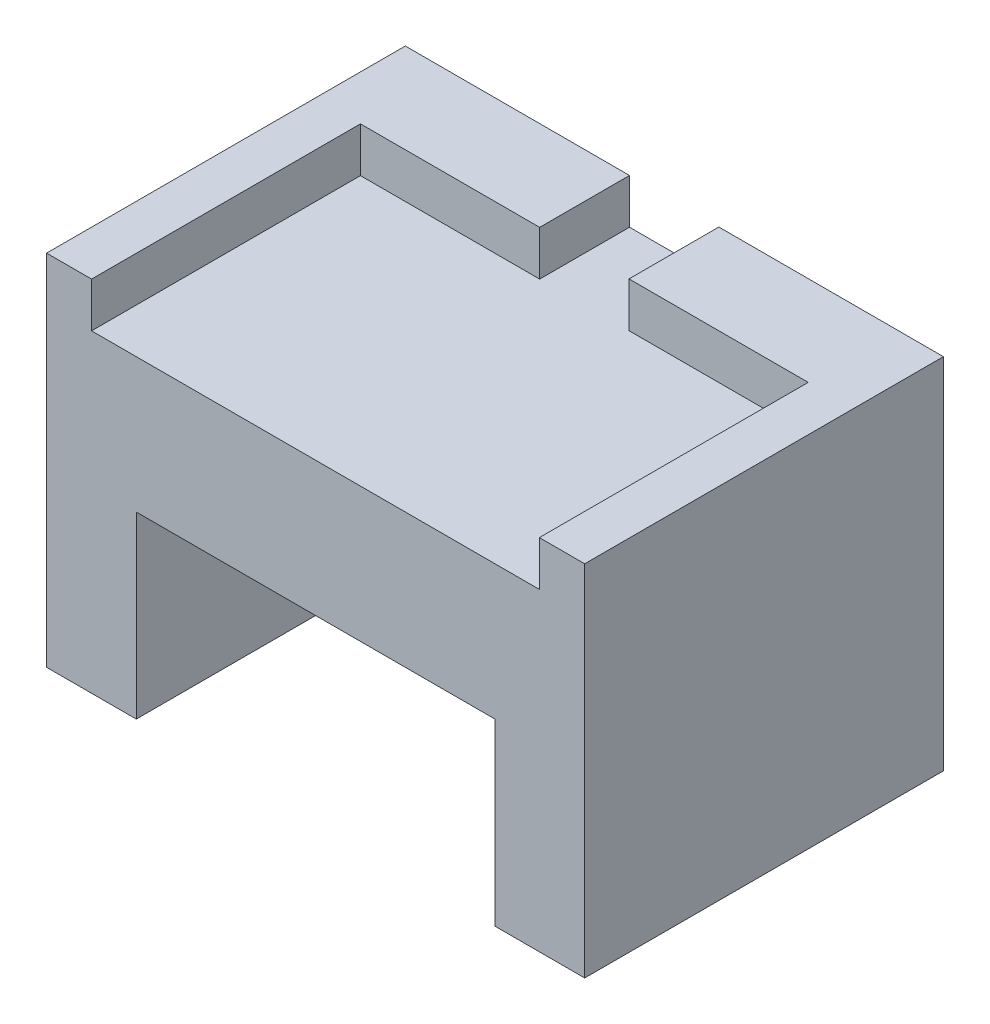
from build123d import *

# Parameters (mm, degrees)
SKETCH2_W           = 76.2
SKETCH2_H           = 25.4
BOSS_EXTRUDE1_DEPTH = 50.8
SKETCH3_W           = 12.7
SKETCH3_H           = 50.8
BOSS_EXTRUDE2_DEPTH = 25.4
SKETCH4_R           = 6.35
BOSS_EXTRUDE3_DEPTH = 50.8
SKETCH7_W           = 12.6492
SKETCH7_H           = 12.7254
CUT_EXTRUDE1_DEPTH  = 6.35


with BuildPart() as part:
    # Sketch2 → Boss-Extrude1 (new body)
    with BuildSketch(Plane.XY):
        with Locations((30.119125683, -4.19863388)):
            Rectangle(SKETCH2_W, SKETCH2_H)
    extrude(amount=BOSS_EXTRUDE1_DEPTH)

    # Sketch3 → Boss-Extrude2 (add)
    with BuildSketch(Plane.XZ.offset(16.89863388)):
        with Locations((-1.630874317, 25.4)):
            Rectangle(SKETCH3_W, SKETCH3_H)
        with Locations((61.869125683, 25.4)):
            Rectangle(SKETCH3_W, SKETCH3_H)
    extrude(amount=BOSS_EXTRUDE2_DEPTH)

    # Sketch4 → Boss-Extrude3 (add)
    with BuildSketch(Plane(origin=(4.719125683, 0, 0), x_dir=(0, 0, -1), z_dir=(1, 0, 0))):
        with Locations(Location((-25.4, -29.59863388, 0), (0, 0, 180))):
            Circle(SKETCH4_R)
    extrude(amount=BOSS_EXTRUDE3_DEPTH)

    # Sketch7 → Cut-Extrude1 (cut)
    with BuildSketch(Plane(origin=(0, 8.50136612, 0), x_dir=(1, 0, 0), z_dir=(0, 1, 0))):
        Polygon((-1.610554317, -12.7254), (-1.610554317, -50.8), (61.798005683, -50.8), (61.798005683, -12.7254), (36.418325683, -12.7254), (23.769125683, -12.7254), align=None)
        with Locations((30.093725683, -6.3627)):
            Rectangle(SKETCH7_W, SKETCH7_H)
    extrude(amount=-CUT_EXTRUDE1_DEPTH, mode=Mode.SUBTRACT)


solid = part.part
